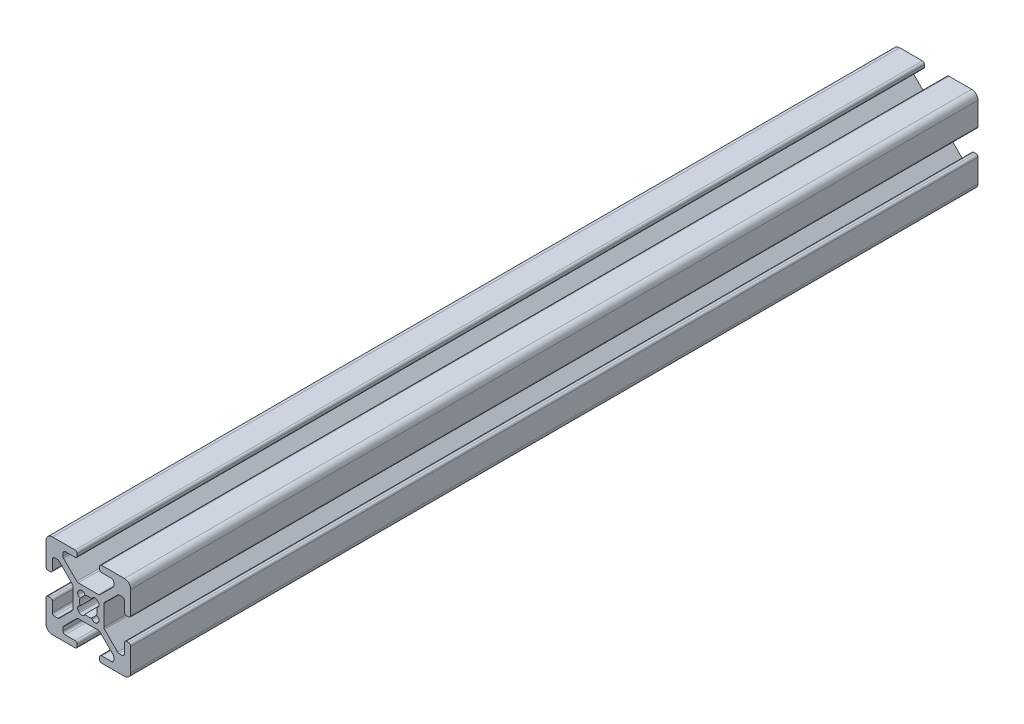
from build123d import *

# Parameters (mm, degrees)
BOSS_EXTRUDE1_DEPTH = 200


with BuildPart() as part:
    # Sketch1 → Boss-Extrude1 (new body)
    with BuildSketch(Plane.XY.offset(4000)):
        with BuildLine():
            Line((10, 3.138), (10, 8.5))
            ThreePointArc((10, 8.5), (9.560660172, 9.560660172), (8.5, 10))
            Line((8.5, 10), (3.138, 10))
            ThreePointArc((3.138, 10), (2.778789755, 9.851210245), (2.63, 9.492))
            Line((2.63, 9.492), (2.63, 9.008))
            ThreePointArc((2.63, 9.008), (2.778789755, 8.648789755), (3.138, 8.5))
            Line((3.138, 8.5), (5.487, 8.5))
            ThreePointArc((5.487, 8.5), (5.846210245, 8.351210245), (5.995, 7.992))
            Line((5.995, 7.992), (5.995, 7.266080661))
            ThreePointArc((5.995, 7.266080661), (5.956330803, 7.071677478), (5.846210245, 6.906870417))
            Line((5.846210245, 6.906870417), (2.743129583, 3.803789755))
            ThreePointArc((2.743129583, 3.803789755), (2.578322522, 3.693669197), (2.383919339, 3.655))
            Line((2.383919339, 3.655), (-2.383919339, 3.655))
            ThreePointArc((-2.383919339, 3.655), (-2.578322522, 3.693669197), (-2.743129583, 3.803789755))
            Line((-2.743129583, 3.803789755), (-5.846210245, 6.906870417))
            ThreePointArc((-5.846210245, 6.906870417), (-5.956330803, 7.071677478), (-5.995, 7.266080661))
            Line((-5.995, 7.266080661), (-5.995, 7.992))
            ThreePointArc((-5.995, 7.992), (-5.846210245, 8.351210245), (-5.487, 8.5))
            Line((-5.487, 8.5), (-3.138, 8.5))
            ThreePointArc((-3.138, 8.5), (-2.778789755, 8.648789755), (-2.63, 9.008))
            Line((-2.63, 9.008), (-2.63, 9.492))
            ThreePointArc((-2.63, 9.492), (-2.778789755, 9.851210245), (-3.138, 10))
            Line((-3.138, 10), (-8.5, 10))
            ThreePointArc((-8.5, 10), (-9.560660172, 9.560660172), (-10, 8.5))
            Line((-10, 8.5), (-10, 3.138))
            ThreePointArc((-10, 3.138), (-9.851210245, 2.778789755), (-9.492, 2.63))
            Line((-9.492, 2.63), (-9.008, 2.63))
            ThreePointArc((-9.008, 2.63), (-8.648789755, 2.778789755), (-8.5, 3.138))
            Line((-8.5, 3.138), (-8.5, 5.487))
            ThreePointArc((-8.5, 5.487), (-8.351210245, 5.846210245), (-7.992, 5.995))
            Line((-7.992, 5.995), (-7.266080661, 5.995))
            ThreePointArc((-7.266080661, 5.995), (-7.071677478, 5.956330803), (-6.906870417, 5.846210245))
            Line((-6.906870417, 5.846210245), (-3.803789755, 2.743129583))
            ThreePointArc((-3.803789755, 2.743129583), (-3.693669197, 2.578322522), (-3.655, 2.383919339))
            Line((-3.655, 2.383919339), (-3.655, -2.383919339))
            ThreePointArc((-3.655, -2.383919339), (-3.693669197, -2.578322522), (-3.803789755, -2.743129583))
            Line((-3.803789755, -2.743129583), (-6.906870417, -5.846210245))
            ThreePointArc((-6.906870417, -5.846210245), (-7.071677478, -5.956330803), (-7.266080661, -5.995))
            Line((-7.266080661, -5.995), (-7.992, -5.995))
            ThreePointArc((-7.992, -5.995), (-8.351210245, -5.846210245), (-8.5, -5.487))
            Line((-8.5, -5.487), (-8.5, -3.138))
            ThreePointArc((-8.5, -3.138), (-8.648789755, -2.778789755), (-9.008, -2.63))
            Line((-9.008, -2.63), (-9.492, -2.63))
            ThreePointArc((-9.492, -2.63), (-9.851210245, -2.778789755), (-10, -3.138))
            Line((-10, -3.138), (-10, -8.5))
            ThreePointArc((-10, -8.5), (-9.560660172, -9.560660172), (-8.5, -10))
            Line((-8.5, -10), (-3.138, -10))
            ThreePointArc((-3.138, -10), (-2.778789755, -9.851210245), (-2.63, -9.492))
            Line((-2.63, -9.492), (-2.63, -9.008))
            ThreePointArc((-2.63, -9.008), (-2.778789755, -8.648789755), (-3.138, -8.5))
            Line((-3.138, -8.5), (-5.487, -8.5))
            ThreePointArc((-5.487, -8.5), (-5.846210245, -8.351210245), (-5.995, -7.992))
            Line((-5.995, -7.992), (-5.995, -7.266080661))
            ThreePointArc((-5.995, -7.266080661), (-5.956330803, -7.071677478), (-5.846210245, -6.906870417))
            Line((-5.846210245, -6.906870417), (-2.743129583, -3.803789755))
            ThreePointArc((-2.743129583, -3.803789755), (-2.578322522, -3.693669197), (-2.383919339, -3.655))
            Line((-2.383919339, -3.655), (2.383919339, -3.655))
            ThreePointArc((2.383919339, -3.655), (2.578322522, -3.693669197), (2.743129583, -3.803789755))
            Line((2.743129583, -3.803789755), (5.846210245, -6.906870417))
            ThreePointArc((5.846210245, -6.906870417), (5.956330803, -7.071677478), (5.995, -7.266080661))
            Line((5.995, -7.266080661), (5.995, -7.992))
            ThreePointArc((5.995, -7.992), (5.846210245, -8.351210245), (5.487, -8.5))
            Line((5.487, -8.5), (3.138, -8.5))
            ThreePointArc((3.138, -8.5), (2.778789755, -8.648789755), (2.63, -9.008))
            Line((2.63, -9.008), (2.63, -9.492))
            ThreePointArc((2.63, -9.492), (2.778789755, -9.851210245), (3.138, -10))
            Line((3.138, -10), (8.5, -10))
            ThreePointArc((8.5, -10), (9.560660172, -9.560660172), (10, -8.5))
            Line((10, -8.5), (10, -3.138))
            ThreePointArc((10, -3.138), (9.851210245, -2.778789755), (9.492, -2.63))
            Line((9.492, -2.63), (9.008, -2.63))
            ThreePointArc((9.008, -2.63), (8.648789755, -2.778789755), (8.5, -3.138))
            Line((8.5, -3.138), (8.5, -5.487))
            ThreePointArc((8.5, -5.487), (8.351210245, -5.846210245), (7.992, -5.995))
            Line((7.992, -5.995), (7.266080661, -5.995))
            ThreePointArc((7.266080661, -5.995), (7.071677478, -5.956330803), (6.906870417, -5.846210245))
            Line((6.906870417, -5.846210245), (3.803789755, -2.743129583))
            ThreePointArc((3.803789755, -2.743129583), (3.693669197, -2.578322522), (3.655, -2.383919339))
            Line((3.655, -2.383919339), (3.655, 2.383919339))
            ThreePointArc((3.655, 2.383919339), (3.693669197, 2.578322522), (3.803789755, 2.743129583))
            Line((3.803789755, 2.743129583), (6.906870417, 5.846210245))
            ThreePointArc((6.906870417, 5.846210245), (7.071677478, 5.956330803), (7.266080661, 5.995))
            Line((7.266080661, 5.995), (7.992, 5.995))
            ThreePointArc((7.992, 5.995), (8.351210245, 5.846210245), (8.5, 5.487))
            Line((8.5, 5.487), (8.5, 3.138))
            ThreePointArc((8.5, 3.138), (8.648789755, 2.778789755), (9.008, 2.63))
            Line((9.008, 2.63), (9.492, 2.63))
            ThreePointArc((9.492, 2.63), (9.851210245, 2.778789755), (10, 3.138))
        make_face()
        with BuildLine():
            Line((-2.124900844, -2.304505966), (-2.304505966, -2.124900844))
            ThreePointArc((-2.304505966, -2.124900844), (-2.505938017, -1.356467811), (-1.935133506, -0.803976718))
            ThreePointArc((-1.935133506, -0.803976718), (-2.0955, 0), (-1.935133506, 0.803976718))
            ThreePointArc((-1.935133506, 0.803976718), (-2.505938017, 1.356467811), (-2.304505966, 2.124900844))
            Line((-2.304505966, 2.124900844), (-2.124900844, 2.304505966))
            ThreePointArc((-2.124900844, 2.304505966), (-1.356467811, 2.505938017), (-0.803976718, 1.935133506))
            ThreePointArc((-0.803976718, 1.935133506), (0, 2.0955), (0.803976718, 1.935133506))
            ThreePointArc((0.803976718, 1.935133506), (1.356467811, 2.505938017), (2.124900844, 2.304505966))
            Line((2.124900844, 2.304505966), (2.304505966, 2.124900844))
            ThreePointArc((2.304505966, 2.124900844), (2.505938017, 1.356467811), (1.935133506, 0.803976718))
            ThreePointArc((1.935133506, 0.803976718), (2.0955, 0), (1.935133506, -0.803976718))
            ThreePointArc((1.935133506, -0.803976718), (2.505938017, -1.356467811), (2.304505966, -2.124900844))
            Line((2.304505966, -2.124900844), (2.124900844, -2.304505966))
            ThreePointArc((2.124900844, -2.304505966), (1.356467811, -2.505938017), (0.803976718, -1.935133506))
            ThreePointArc((0.803976718, -1.935133506), (0, -2.0955), (-0.803976718, -1.935133506))
            ThreePointArc((-0.803976718, -1.935133506), (-1.356467811, -2.505938017), (-2.124900844, -2.304505966))
        make_face(mode=Mode.SUBTRACT)
    extrude(amount=-BOSS_EXTRUDE1_DEPTH)


solid = part.part
